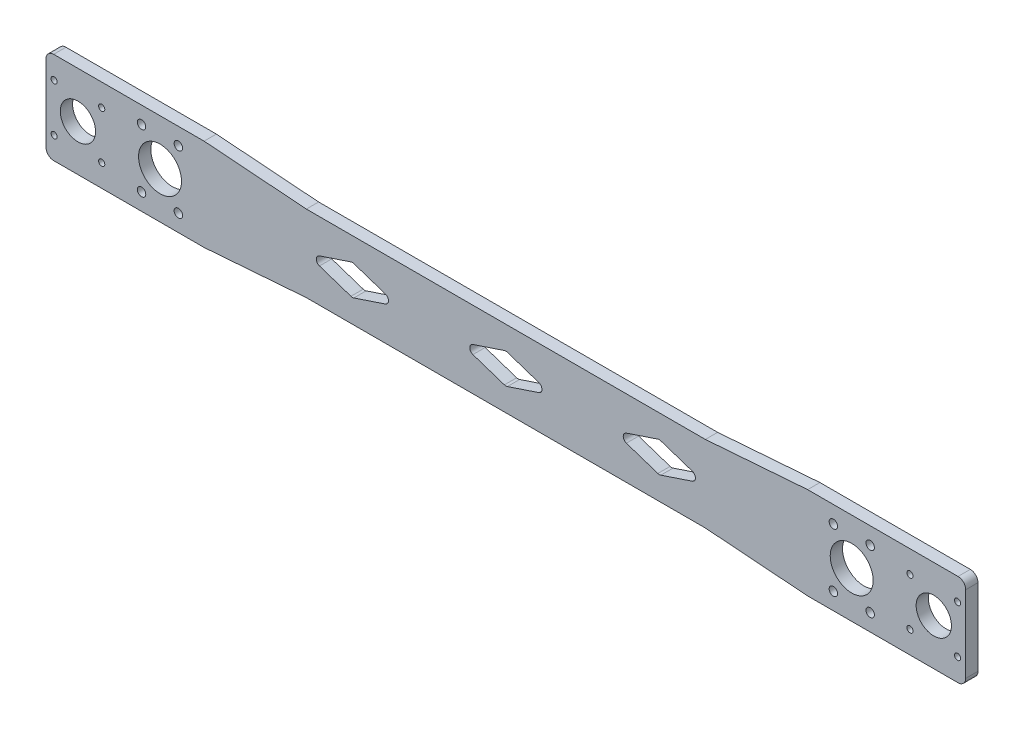
from build123d import *

# Parameters (mm, degrees)
EXTRUDE_1_DEPTH     = 8
FILLET_1_R          = 3
FILLET_2_R          = 5
SKETCH_2_R          = 14
CUT_EXTRUDE_1_DEPTH = 10
SKETCH_3_R          = 2.75
CUT_EXTRUDE_2_DEPTH = 10
SKETCH_4_R          = 11.5
SKETCH_4_R_2        = 2
CUT_EXTRUDE_3_DEPTH = 10


with BuildPart() as part:
    # 草图1 → 凸台-拉伸1 (new body)
    with BuildSketch(Plane.XY):
        Polygon((0, 0), (103, 0), (169.65, -5), (429.65, -5), (496.3, 0), (599.3, 0), (599.3, -60), (496.3, -60), (429.65, -55), (169.65, -55), (103, -60), (0, -60), align=None)
        Polygon((169.65, -30), (199.65, -20), (229.65, -30), (199.65, -40), align=None, mode=Mode.SUBTRACT)
        Polygon((269.65, -30), (299.65, -20), (329.65, -30), (299.65, -40), align=None, mode=Mode.SUBTRACT)
        Polygon((369.65, -30), (399.65, -20), (429.65, -30), (399.65, -40), align=None, mode=Mode.SUBTRACT)
    extrude(amount=EXTRUDE_1_DEPTH)

    # 圆角1
    fillet_1_edges = [part.edges().sort_by_distance(p)[0] for p in [
        (269.65, -30, 4),
        (299.65, -40, 4),
        (329.65, -30, 4),
        (299.65, -20, 4),
        (169.65, -30, 4),
        (199.65, -40, 4),
        (229.65, -30, 4),
        (199.65, -20, 4),
        (369.65, -30, 4),
        (399.65, -40, 4),
        (429.65, -30, 4),
        (399.65, -20, 4),
    ]]
    fillet(fillet_1_edges, radius=FILLET_1_R)

    # 圆角2
    fillet_2_edges = [part.edges().sort_by_distance(p)[0] for p in [
        (0, 0, 4),
        (599.3, 0, 4),
        (599.3, -60, 4),
        (0, -60, 4),
    ]]
    fillet(fillet_2_edges, radius=FILLET_2_R)

    # 草图2 → 切除-拉伸1 (cut)
    with BuildSketch(Plane.XY.offset(8)):
        with Locations((74.3, -30)):
            Circle(SKETCH_2_R)
        with Locations((525, -30)):
            Circle(SKETCH_2_R)
    extrude(amount=-CUT_EXTRUDE_1_DEPTH, mode=Mode.SUBTRACT)

    # 草图3 → 切除-拉伸2 (cut)
    with BuildSketch(Plane(origin=(0, 0, 0), x_dir=(-1, 0, 0), z_dir=(0, 0, -1))):
        with Locations((-537.05, -11)):
            Circle(SKETCH_3_R)
        with Locations((-513.05, -11)):
            Circle(SKETCH_3_R)
        with Locations((-513.05, -49)):
            Circle(SKETCH_3_R)
        with Locations((-537.05, -49)):
            Circle(SKETCH_3_R)
        with Locations(Location((-62.25, -49, 0), (0, 0, 180))):
            Circle(SKETCH_3_R)
        with Locations(Location((-86.25, -49, 0), (0, 0, 180))):
            Circle(SKETCH_3_R)
        with Locations(Location((-86.25, -11, 0), (0, 0, 180))):
            Circle(SKETCH_3_R)
        with Locations(Location((-62.25, -11, 0), (0, 0, 180))):
            Circle(SKETCH_3_R)
    extrude(amount=-CUT_EXTRUDE_2_DEPTH, mode=Mode.SUBTRACT)

    # 草图4 → 切除-拉伸3 (cut)
    with BuildSketch(Plane.XY.offset(8)):
        with Locations((20.8, -30)):
            Circle(SKETCH_4_R)
        with Locations((5.3, -14.5)):
            Circle(SKETCH_4_R_2)
        with Locations((36.3, -14.5)):
            Circle(SKETCH_4_R_2)
        with Locations((36.3, -45.5)):
            Circle(SKETCH_4_R_2)
        with Locations((5.3, -45.5)):
            Circle(SKETCH_4_R_2)
        with Locations((563, -45.5)):
            Circle(SKETCH_4_R_2)
        with Locations((594, -45.5)):
            Circle(SKETCH_4_R_2)
        with Locations((594, -14.5)):
            Circle(SKETCH_4_R_2)
        with Locations((563, -14.5)):
            Circle(SKETCH_4_R_2)
        with Locations((578.5, -30)):
            Circle(SKETCH_4_R)
    extrude(amount=-CUT_EXTRUDE_3_DEPTH, mode=Mode.SUBTRACT)


solid = part.part
